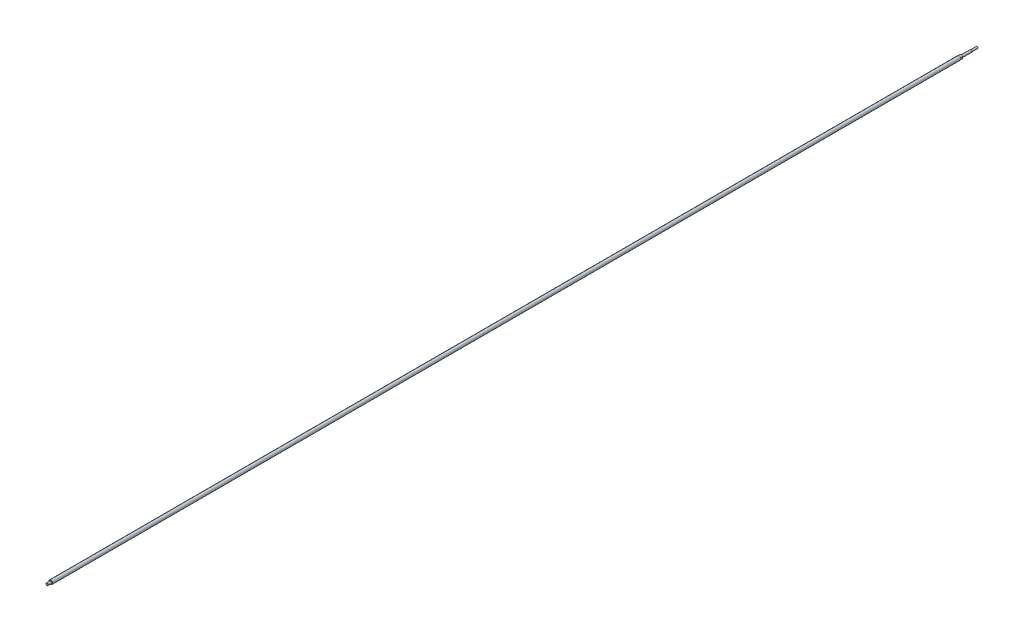
from build123d import *

# Parameters (mm, degrees)
SKETCH1_R           = 5
BOSS_EXTRUDE1_DEPTH = 2500
SKETCH2_R           = 5
SKETCH2_R_2         = 4.75
CUT_EXTRUDE1_DEPTH  = 49.5
SKETCH3_R           = 4.75
SKETCH3_R_2         = 3
CUT_EXTRUDE2_DEPTH  = 43
CUT_EXTRUDE3_DEPTH  = 6.5
SKETCH6_R           = 3
SKETCH6_R_2         = 2.5
CUT_EXTRUDE4_DEPTH  = 16
CUT_EXTRUDE5_START  = -10
SKETCH7_R           = 5
SKETCH7_R_2         = 3
CUT_EXTRUDE5_DEPTH  = 10


with BuildPart() as part:
    # Sketch1 → Boss-Extrude1 (new body)
    with BuildSketch(Plane.XY):
        Circle(SKETCH1_R)
    extrude(amount=BOSS_EXTRUDE1_DEPTH)

    # Sketch2 → Cut-Extrude1 (cut)
    with BuildSketch(Plane(origin=(0, 0, 0), x_dir=(-1, 0, 0), z_dir=(0, 0, -1))):
        Circle(SKETCH2_R)
        Circle(SKETCH2_R_2, mode=Mode.SUBTRACT)
    extrude(amount=-CUT_EXTRUDE1_DEPTH, mode=Mode.SUBTRACT)

    # Sketch3 → Cut-Extrude2 (cut)
    with BuildSketch(Plane(origin=(0, 0, 0), x_dir=(-1, 0, 0), z_dir=(0, 0, -1))):
        Circle(SKETCH3_R)
        Circle(SKETCH3_R_2, mode=Mode.SUBTRACT)
    extrude(amount=-CUT_EXTRUDE2_DEPTH, mode=Mode.SUBTRACT)

    # Sketch5 → Cut-Extrude3 (cut)
    with BuildSketch(Plane(origin=(0, 0, 43), x_dir=(-1, 0, 0), z_dir=(0, 0, -1))):
        with BuildLine():
            Line((-4, 2.561737691), (-4, -2.561737691))
            ThreePointArc((-4, -2.561737691), (-4.75, 0), (-4, 2.561737691))
        make_face()
        with BuildLine():
            Line((4, 2.561737691), (4, -2.561737691))
            ThreePointArc((4, -2.561737691), (4.75, 0), (4, 2.561737691))
        make_face()
    extrude(amount=-CUT_EXTRUDE3_DEPTH, mode=Mode.SUBTRACT)

    # Sketch6 → Cut-Extrude4 (cut)
    with BuildSketch(Plane(origin=(0, 0, 0), x_dir=(-1, 0, 0), z_dir=(0, 0, -1))):
        Circle(SKETCH6_R)
        Circle(SKETCH6_R_2, mode=Mode.SUBTRACT)
    extrude(amount=-CUT_EXTRUDE4_DEPTH, mode=Mode.SUBTRACT)

    # Sketch7 → Cut-Extrude5 (cut)
    with BuildSketch(Plane.XY.offset(2500).offset(CUT_EXTRUDE5_START)):
        with Locations(Location((0, 0, 0), (0, 0, 180))):
            Circle(SKETCH7_R)
        with Locations(Location((0, 0, 0), (0, 0, 180))):
            Circle(SKETCH7_R_2, mode=Mode.SUBTRACT)
    extrude(amount=CUT_EXTRUDE5_DEPTH, mode=Mode.SUBTRACT)


solid = part.part
